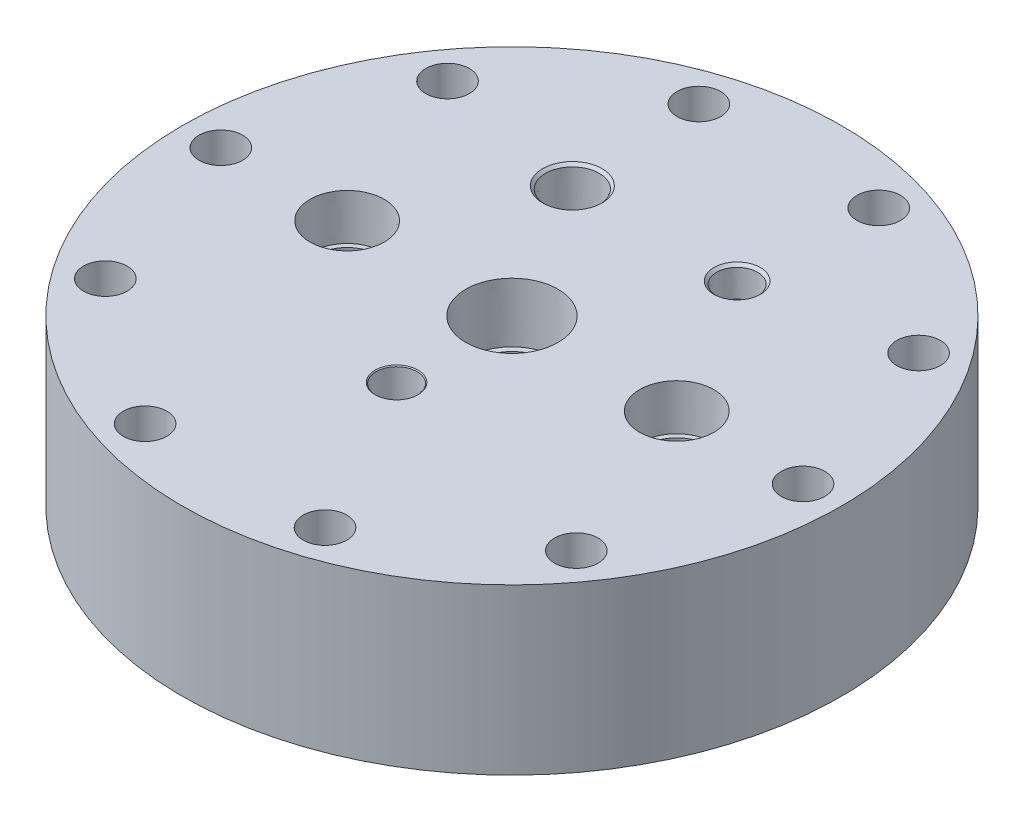
from build123d import *

# Parameters (mm, degrees)
F_3_8_NPT_TAPPED_HOLE1_AT_2_COUNT = 2
F_3_8_NPT_TAPPED_HOLE1_AT_2_PITCH = 76.2
F_3_8_CLEARANCE_HOLE2_D           = 10.0838
CIRPATTERN1_COUNT                 = 10
SKETCH15_R                        = 3.175
CUT_EXTRUDE1_DEPTH                = 12.7
SKETCH18_R                        = 1.27
CUT_EXTRUDE2_DEPTH                = 3.302


with BuildPart() as part:
    # Sketch1 → Revolve1 (revolve)
    with BuildSketch(Plane.XY):
        Polygon((0, 0), (-76.2, 0), (-76.2, -38.1), (-60.96, -38.1), (-60.96, -32.258), (-55.7149, -32.258), (-55.7149, -29.5656), (-51.6509, -29.5656), (-51.6509, -32.258), (-32.163982831, -32.258), (-30.364664072, -32.258), (-28.575, -32.258), (-28.575, -27.178), (-28.0924, -27.178), (-28.0924, -24.4856), (-24.0284, -24.4856), (-24.0284, -27.178), (-22.225, -27.178), (0, -15.85722), align=None)
    revolve(axis=Axis((0, 0, 0), (0, -1, 0)))

    # Sketch3 → 1/2 NPT Tapped Hole1 (revolve, cut)
    with BuildSketch(Plane(origin=(0, 0, 0), x_dir=(0, 0, 1), z_dir=(1, 0, 0))):
        Polygon((0, 0), (0, 38.1), (8.9281, 38.1), (8.9281, 13.462), (10.261665792, 13.462), (10.6647361, 0), align=None)
    revolve(axis=Axis((0, 6.35, 0), (0, -1, 0)), mode=Mode.SUBTRACT)

    # Sketch5 → 3/8 NPT Tapped Hole1 (revolve, cut)
    with BuildSketch(Plane(origin=(-38.1, 0, 0), x_dir=(0, 0, 1), z_dir=(1, 0, 0))):
        Polygon((0, 0), (0, 38.1), (7.1374, 38.1), (7.1374, 10.414), (8.263205494, 10.414), (8.5750146, 0), align=None)
    f_3_8_npt_tapped_hole1 = revolve(axis=Axis((-38.1, 6.35, 0), (0, -1, 0)), mode=Mode.SUBTRACT)

    # 3/8 NPT Tapped Hole1 at 2: 3/8 NPT Tapped Hole1 ×2
    with Locations(*[(i * F_3_8_NPT_TAPPED_HOLE1_AT_2_PITCH, 0, 0) for i in range(1, F_3_8_NPT_TAPPED_HOLE1_AT_2_COUNT)]):
        add(f_3_8_npt_tapped_hole1, mode=Mode.SUBTRACT)

    # 3/8 Clearance Hole2 (through all)
    with Locations(Plane(origin=(67.31, 0, 0), x_dir=(1, 0, 0), z_dir=(0, 1, 0))):
        with Locations((0, 0)):
            f_3_8_clearance_hole2 = Hole(F_3_8_CLEARANCE_HOLE2_D / 2)

    # CirPattern1: 3/8 Clearance Hole2 ×10 about axis
    cirpattern1_axis = Axis((0, 0, 0), (0, 1, 0))
    for i in range(1, CIRPATTERN1_COUNT):
        add(f_3_8_clearance_hole2.rotate(cirpattern1_axis, i * 360 / CIRPATTERN1_COUNT), mode=Mode.SUBTRACT)

    # Sketch7 → 1/8 NPT Tapped Hole2 (revolve, cut)
    with BuildSketch(Plane(origin=(19.05, 0, -33.02), x_dir=(0, 0, 1), z_dir=(1, 0, 0))):
        Polygon((0, 0), (0, 38.1), (4.2164, 38.1), (4.2164, 6.858), (4.556413846, 6.858), (4.7427388, 0.635), (5.3777388, 0), align=None)
    revolve(axis=Axis((19.05, 6.35, -33.02), (0, -1, 0)), mode=Mode.SUBTRACT)

    # Sketch15 → Cut-Extrude1 (cut, symmetric)
    with BuildSketch(Plane(origin=(0, -4.272551224, -4.272551224), x_dir=(0, 0.7071067811865489, -0.7071067811865461), z_dir=(0, -0.7071067811865461, -0.7071067811865489))):
        with Locations((-30.172299887, 0)):
            Circle(SKETCH15_R)
    extrude(amount=CUT_EXTRUDE1_DEPTH, both=True, mode=Mode.SUBTRACT)

    # Sketch12 → 1/8 NPT Tapped Hole3 (revolve, cut)
    with BuildSketch(Plane(origin=(0, 0, 26.67), x_dir=(0, 0, 1), z_dir=(1, 0, 0))):
        Polygon((0, 0), (0, 20.32), (4.2164, 17.786531286), (4.2164, 6.858), (4.543696598, 6.858), (4.7427388, 0.2102612), (4.953, 0), align=None)
    revolve(axis=Axis((0, 6.35, 26.67), (0, -1, 0)), mode=Mode.SUBTRACT)

    # Sketch17 → 1/4 NPT Tapped Hole1 (revolve, cut)
    with BuildSketch(Plane(origin=(-19.05, 0, -33.02), x_dir=(0, 0, 1), z_dir=(1, 0, 0))):
        Polygon((0, 0), (0, 38.1), (5.5626, 38.1), (5.5626, 9.906), (5.962698545, 9.906), (6.2402847, 0.635), (6.8752847, 0), align=None)
    revolve(axis=Axis((-19.05, 6.35, -33.02), (0, -1, 0)), mode=Mode.SUBTRACT)

    # Sketch18 → Cut-Extrude2 (cut)
    with BuildSketch(Plane.XZ.offset(32.258)):
        with Locations((0, 44.45)):
            Circle(SKETCH18_R)
        with Locations((0, -44.45)):
            Circle(SKETCH18_R)
    extrude(amount=-CUT_EXTRUDE2_DEPTH, mode=Mode.SUBTRACT)


solid = part.part
